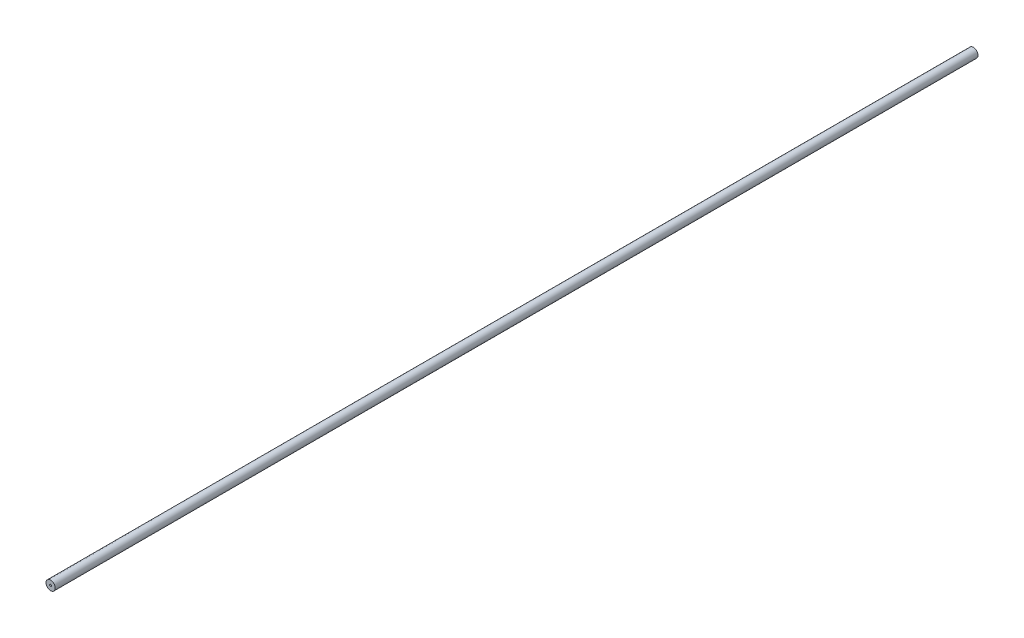
from build123d import *

# Parameters (mm, degrees)
SKETCH_1_R      = 2.5
SKETCH_1_R_2    = 0.5
EXTRUDE_2_DEPTH = 500


with BuildPart() as part:
    # 草圖1 → 伸長-薄件2 (new body)
    with BuildSketch(Plane.XY):
        Circle(SKETCH_1_R)
        Circle(SKETCH_1_R_2, mode=Mode.SUBTRACT)
    extrude(amount=EXTRUDE_2_DEPTH)


solid = part.part
